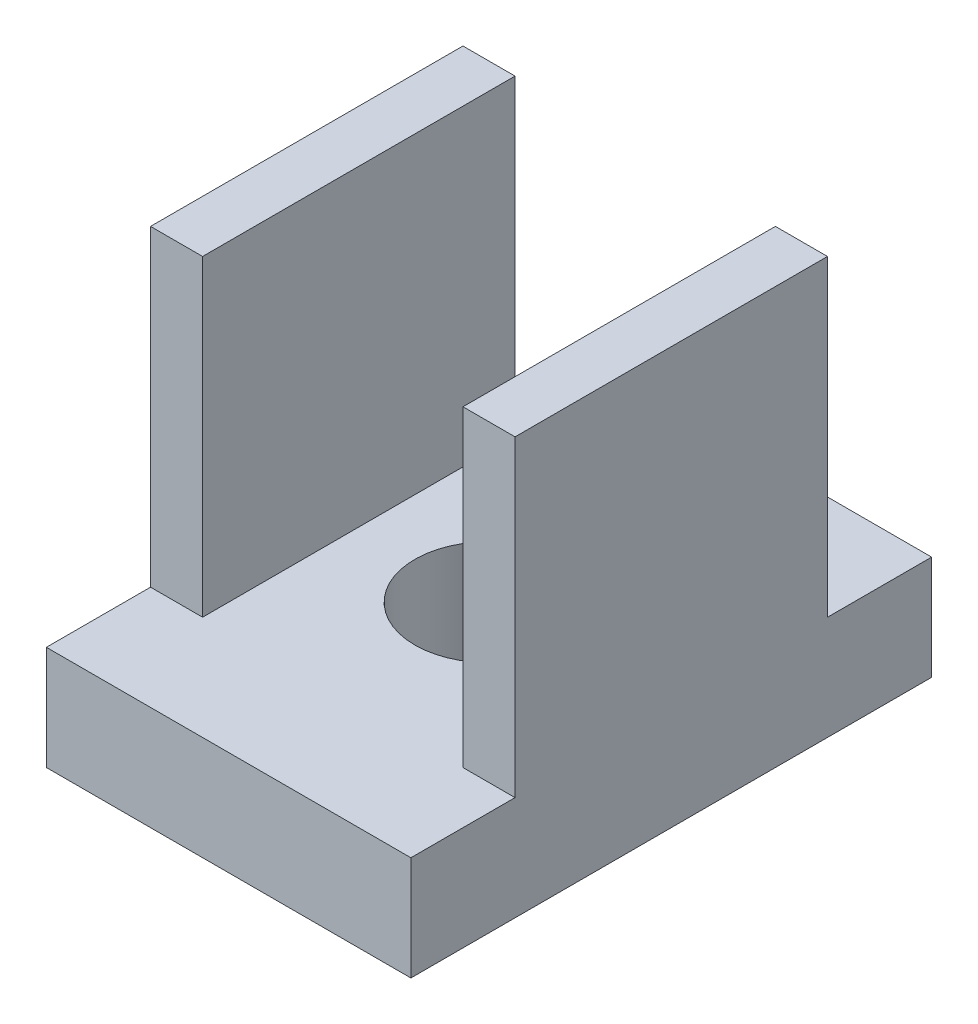
from build123d import *

# Parameters (mm, degrees)
SKETCH1_W           = 7
SKETCH1_H           = 10
BOSS_EXTRUDE1_DEPTH = 2
SKETCH2_R           = 1.425
CUT_EXTRUDE1_DEPTH  = 7.422616289
SKETCH3_W           = 1
SKETCH3_H           = 6
BOSS_EXTRUDE2_DEPTH = 6


with BuildPart() as part:
    # Sketch1 → Boss-Extrude1 (new body)
    with BuildSketch(Plane(origin=(0, 0, 0), x_dir=(1, 0, 0), z_dir=(0, 1, 0))):
        Rectangle(SKETCH1_W, SKETCH1_H)
    extrude(amount=BOSS_EXTRUDE1_DEPTH)

    # Sketch2 → Cut-Extrude1 (cut, through all)
    with BuildSketch(Plane(origin=(0, 2, 0), x_dir=(1, 0, 0), z_dir=(0, 1, 0))):
        with Locations(Location((0, 0, 0), (0, 0, 270))):
            Circle(SKETCH2_R)
    extrude(amount=-CUT_EXTRUDE1_DEPTH, mode=Mode.SUBTRACT)

    # Sketch3 → Boss-Extrude2 (add)
    with BuildSketch(Plane(origin=(0, 2, 0), x_dir=(1, 0, 0), z_dir=(0, 1, 0))):
        with Locations((-3, 0)):
            Rectangle(SKETCH3_W, SKETCH3_H)
        with Locations((3, 0)):
            Rectangle(SKETCH3_W, SKETCH3_H)
    extrude(amount=BOSS_EXTRUDE2_DEPTH)


solid = part.part
